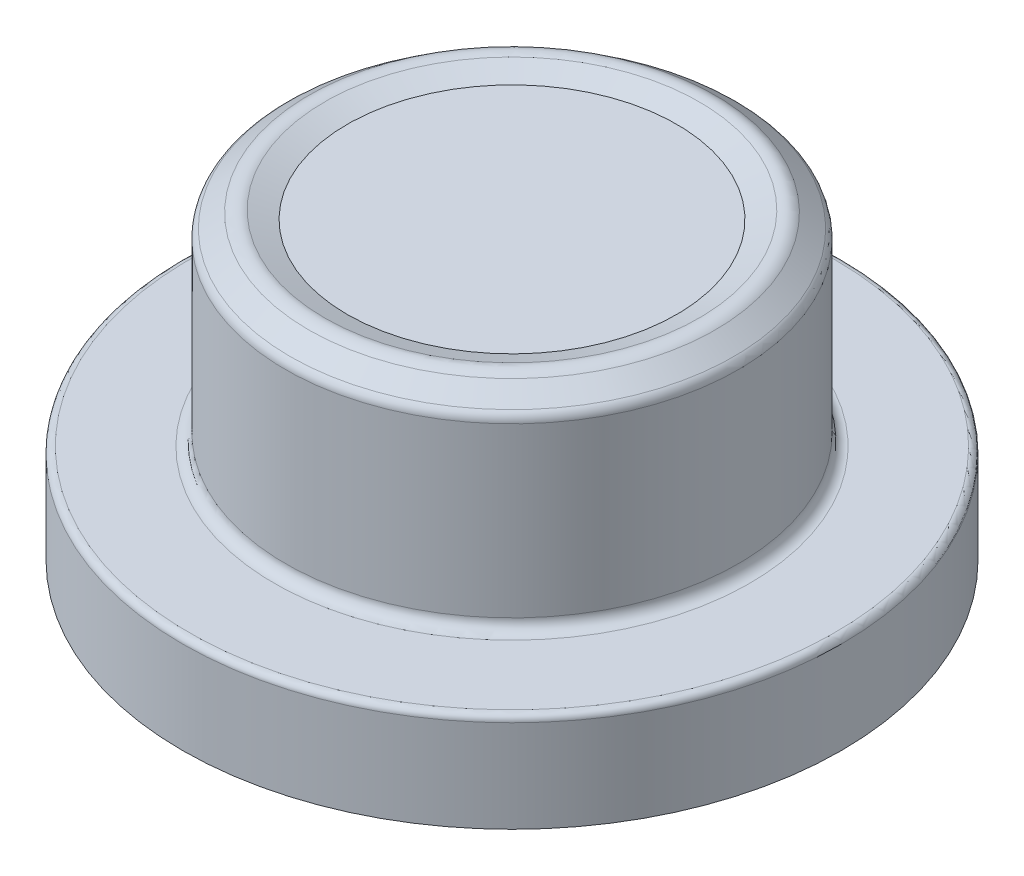
from build123d import *

# Parameters (mm, degrees)
SKETCH5_W   = 11.1125
SKETCH5_H   = 0.254
SKETCH5_W_2 = 0.127
SKETCH5_H_2 = 0.127
FILLET1_R   = 0.436245
FILLET2_R   = 0.254


with BuildPart() as part:
    # Sketch3 → Revolve1 (revolve)
    with BuildSketch(Plane(origin=(0, 0, 0), x_dir=(0, 0, -1), z_dir=(1, 0, 0)), mode=Mode.PRIVATE) as revolve1_sk:
        with BuildLine():
            Line((6.35, 5.575443959), (7.217819816, 5.891304541))
            ThreePointArc((7.217819816, 5.891304541), (7.53745, 5.923980005), (7.8343125, 5.801082499))
            Line((7.8343125, 5.801082499), (8.7249, 5.13842))
            Line((8.7249, 5.13842), (8.7249, -1.9939))
            Line((8.7249, -1.9939), (12.7, -1.9939))
            Line((12.7, -1.9939), (12.7, -5.8039))
            Line((12.7, -5.8039), (11.1125, -5.8039))
            Line((11.1125, -5.8039), (11.1125, -5.6769))
            Line((11.1125, -5.6769), (0, -5.6769))
            Line((0, -5.6769), (0, -0.0127))
            Line((0, -0.0127), (7.53745, -0.0127))
            Line((7.53745, -0.0127), (7.53745, 4.34594))
            Line((7.53745, 4.34594), (6.35, 4.34594))
            Line((6.35, 4.34594), (6.35, 5.575443959))
        make_face()
    revolve(revolve1_sk.sketch.rotate(Axis((0, -0.0127, 0), (0, -1, 0)), 180), axis=Axis((0, -0.0127, 0), (0, -1, 0)))

    # Fillet1
    fillet1_edges = [part.edges().sort_by_distance(p)[0] for p in [
        (0, 5.13842, -8.7249),
        (0, -1.9939, -8.7249),
    ]]
    fillet(fillet1_edges, radius=FILLET1_R)

    # Fillet2
    fillet2_edges = [part.edges().sort_by_distance(p)[0] for p in [
        (0, -1.9939, -12.7),
    ]]
    fillet(fillet2_edges, radius=FILLET2_R)


with BuildPart() as body_2:
    # Sketch4 → Revolve2 (revolve)
    with BuildSketch(Plane(origin=(0, 0, 0), x_dir=(0, 0, -1), z_dir=(1, 0, 0)), mode=Mode.PRIVATE) as revolve2_sk:
        Polygon((6.35, 5.575443959), (0, 5.575443959), (0, 4.34594), (2.794, 4.34594), (2.794, 4.47294), (2.921, 4.47294), (2.921, 4.34594), (6.35, 4.34594), align=None)
    revolve(revolve2_sk.sketch.rotate(Axis((0, 5.575443959, 0), (0, -1, 0)), 180), axis=Axis((0, 5.575443959, 0), (0, -1, 0)))


with BuildPart() as body_3:
    # Sketch5 → Revolve3 (revolve)
    with BuildSketch(Plane(origin=(0, 0, 0), x_dir=(0, 0, -1), z_dir=(1, 0, 0))):
        with Locations((5.55625, -5.8039)):
            Rectangle(SKETCH5_W, SKETCH5_H)
        with Locations((2.8575, 4.40944)):
            Rectangle(SKETCH5_W_2, SKETCH5_H_2)
    revolve(axis=Axis((0, -5.9309, 0), (0, 1, 0)))


solid = Compound([part.part, body_2.part, body_3.part])
